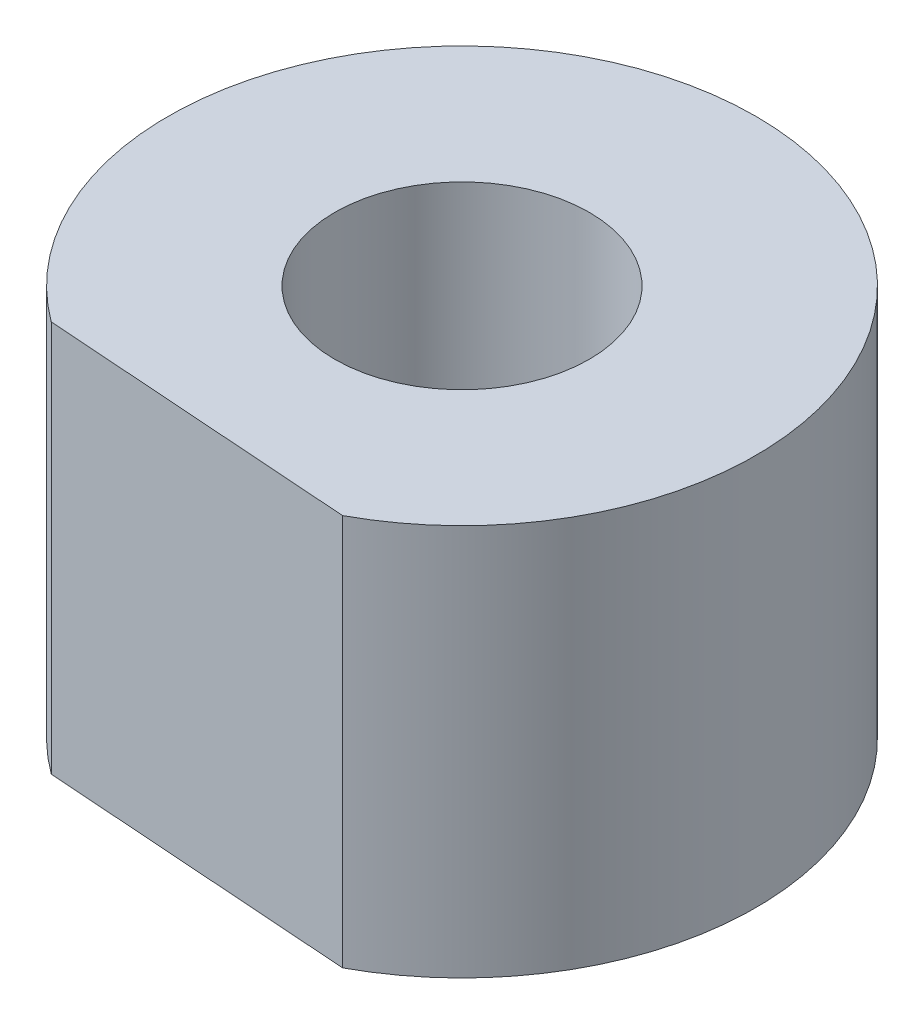
from build123d import *

# Parameters (mm, degrees)
SKETCH1_R           = 3.25
BOSS_EXTRUDE1_DEPTH = 10


with BuildPart() as part:
    # Sketch1 → Boss-Extrude1 (new body)
    with BuildSketch(Plane(origin=(0, 0, 0), x_dir=(1, 0, 0), z_dir=(0, 1, 0))):
        with BuildLine():
            Line((-4.445760987, -6.040298772), (3.554239013, -6.60434592))
            ThreePointArc((3.554239013, -6.60434592), (0.527484743, 7.481427661), (-4.445760987, -6.040298772))
        make_face()
        with Locations(Location((0, 0, 0), (0, 0, 270))):
            Circle(SKETCH1_R, mode=Mode.SUBTRACT)
    extrude(amount=BOSS_EXTRUDE1_DEPTH)


solid = part.part
